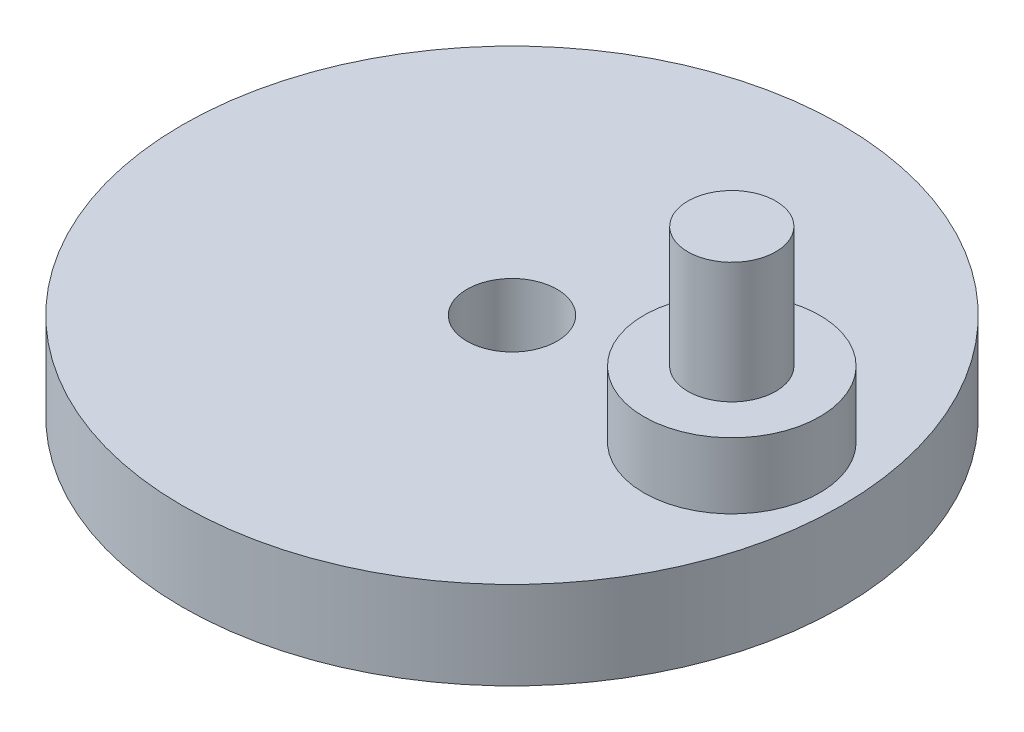
from build123d import *

# Parameters (mm, degrees)
SKETCH_1_R          = 30
EXTRUDE_1_DEPTH     = 8
SKETCH_2_R          = 4.1
CUT_EXTRUDE_1_DEPTH = 44.17406629
SKETCH_3_R          = 8
EXTRUDE_2_DEPTH     = 6
SKETCH_4_R          = 4
EXTRUDE_3_DEPTH     = 11


with BuildPart() as part:
    # 草图1 → 凸台-拉伸1 (new body)
    with BuildSketch(Plane(origin=(0, 0, 0), x_dir=(1, 0, 0), z_dir=(0, 1, 0))):
        with Locations(Location((0, 0, 0), (0, 0, 270))):
            Circle(SKETCH_1_R)
    extrude(amount=EXTRUDE_1_DEPTH)

    # 草图2 → 切除-拉伸1 (cut, through all)
    with BuildSketch(Plane(origin=(0, 8, 0), x_dir=(1, 0, 0), z_dir=(0, 1, 0))):
        with Locations(Location((0, 0, 0), (0, 0, 270))):
            Circle(SKETCH_2_R)
    extrude(amount=-CUT_EXTRUDE_1_DEPTH, mode=Mode.SUBTRACT)

    # 草图3 → 凸台-拉伸2 (add)
    with BuildSketch(Plane(origin=(0, 8, 0), x_dir=(1, 0, 0), z_dir=(0, 1, 0))):
        with Locations(Location((20, 0, 0), (0, 0, 270))):
            Circle(SKETCH_3_R)
    extrude(amount=EXTRUDE_2_DEPTH)

    # 草图4 → 凸台-拉伸3 (add)
    with BuildSketch(Plane(origin=(0, 14, 0), x_dir=(1, 0, 0), z_dir=(0, 1, 0))):
        with Locations(Location((20, 0, 0), (0, 0, 270))):
            Circle(SKETCH_4_R)
    extrude(amount=EXTRUDE_3_DEPTH)


solid = part.part
